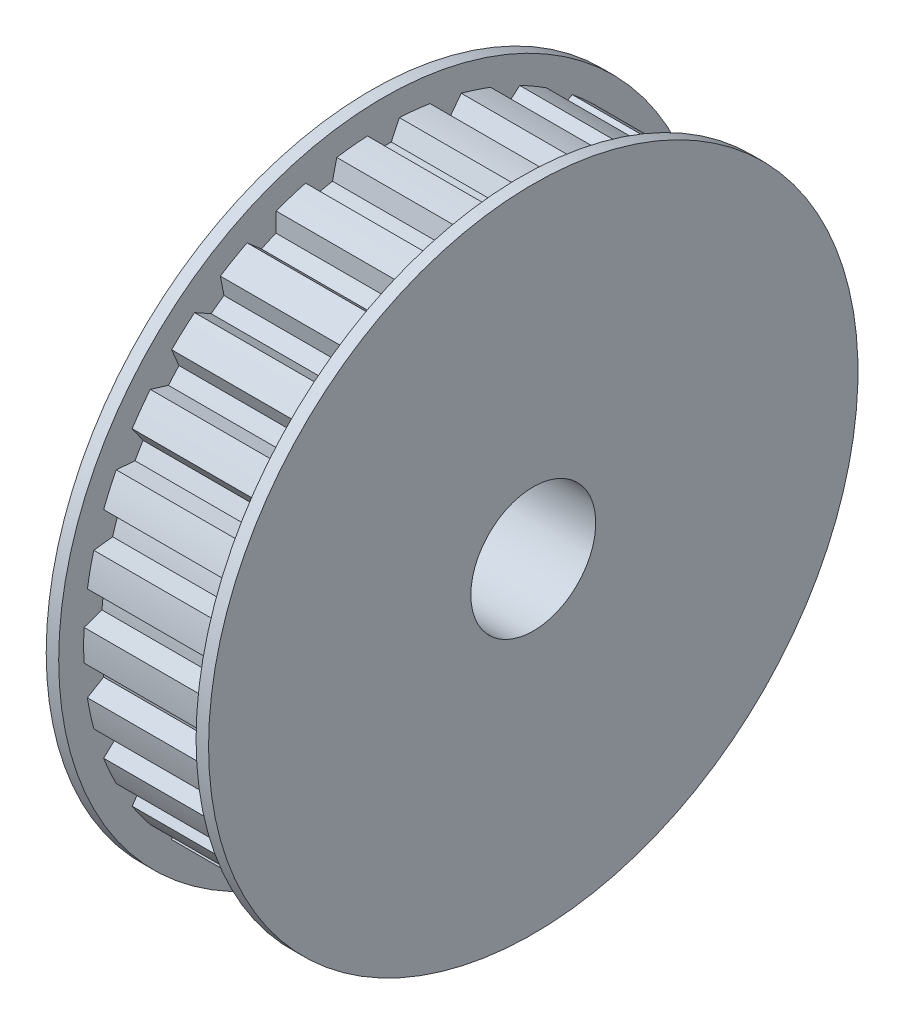
from build123d import *
from build123d.topology import SkipClean

# Parameters (mm, degrees)
SKETCH1_R           = 24
SKETCH1_R_2         = 5
BOSS_EXTRUDE1_DEPTH = 11
CUT_EXTRUDE1_DEPTH  = 36.67912555
BOSS_EXTRUDE2_START = 1
SKETCH3_R           = 26
SKETCH3_R_2         = 5
BOSS_EXTRUDE2_DEPTH = 1
LPATTERN1_COUNT     = 2
LPATTERN1_PITCH     = 12


with BuildPart() as part:
    # Sketch1 → Boss-Extrude1 (new body)
    with BuildSketch(Plane(origin=(0, 0, 0), x_dir=(0, 0, -1), z_dir=(1, 0, 0))):
        Circle(SKETCH1_R)
        Circle(SKETCH1_R_2, mode=Mode.SUBTRACT)
    extrude(amount=BOSS_EXTRUDE1_DEPTH)

    # Sketch2 → Cut-Extrude1 (cut, through all)
    with BuildSketch(Plane.ZY):
        with BuildLine():
            Line((1.276076386, 23.966051595), (0.634916452, 22.59107968))
            ThreePointArc((0.634916452, 22.59107968), (0, 22.6), (-0.634916452, 22.59107968))
            Line((-0.634916452, 22.59107968), (-1.276076386, 23.966051595))
            ThreePointArc((-1.276076386, 23.966051595), (0, 24), (1.276076386, 23.966051595))
        make_face()
        with BuildLine():
            Line((6.231013365, 23.177024668), (5.317991578, 21.965403834))
            ThreePointArc((5.317991578, 21.965403834), (4.698804212, 22.106135777), (4.075907569, 22.22941694))
            Line((4.075907569, 22.22941694), (3.734631254, 23.707647066))
            ThreePointArc((3.734631254, 23.707647066), (4.98988058, 23.475542418), (6.231013365, 23.177024668))
        make_face()
        with BuildLine():
            Line((10.913625159, 21.375050547), (9.768644953, 20.379734438))
            ThreePointArc((9.768644953, 20.379734438), (9.192248134, 20.646127343), (8.608594872, 20.896222011))
            Line((8.608594872, 20.896222011), (8.582117588, 22.413104598))
            ThreePointArc((8.582117588, 22.413104598), (9.761679434, 21.925090983), (10.913625159, 21.375050547))
        make_face()
        with BuildLine():
            Line((15.119259166, 18.638884148), (13.792361669, 17.903372855))
            ThreePointArc((13.792361669, 17.903372855), (13.283946702, 18.283784073), (12.765045269, 18.649761909))
            Line((12.765045269, 18.649761909), (13.054524201, 20.139001909))
            ThreePointArc((13.054524201, 20.139001909), (14.106846055, 19.416407865), (15.119259166, 18.638884148))
        make_face()
        with BuildLine():
            Line((18.664108996, 15.088109073), (17.213285997, 14.644547969))
            ThreePointArc((17.213285997, 14.644547969), (16.795073056, 15.122351704), (16.363601935, 15.58821772))
            Line((16.363601935, 15.58821772), (16.956385464, 16.984728199))
            ThreePointArc((16.956385464, 16.984728199), (17.835475811, 16.059134553), (18.664108996, 15.088109073))
        make_face()
        with BuildLine():
            Line((21.393247703, 10.87791123), (19.881907128, 10.745686063))
            ThreePointArc((19.881907128, 10.745686063), (19.572174126, 11.3), (19.246990676, 11.845393617))
            Line((19.246990676, 11.845393617), (20.117171317, 13.088140365))
            ThreePointArc((20.117171317, 13.088140365), (20.784609691, 12), (21.393247703, 10.87791123))
        make_face()
        with BuildLine():
            Line((23.187398829, 6.192296469), (21.681593513, 6.377186113))
            ThreePointArc((21.681593513, 6.377186113), (21.493877268, 6.983784073), (21.289193566, 7.584868971))
            Line((21.289193566, 7.584868971), (22.39874025, 8.619537993))
            ThreePointArc((22.39874025, 8.619537993), (22.825356391, 7.416407865), (23.187398829, 6.192296469))
        make_face()
        with BuildLine():
            Line((23.96814936, 1.236048638), (22.533690223, 1.729972529))
            ThreePointArc((22.533690223, 1.729972529), (22.476194835, 2.36234327), (22.400956541, 2.992849156))
            Line((22.400956541, 2.992849156), (23.701376753, 3.77422045))
            ThreePointArc((23.701376753, 3.77422045), (23.868525489, 2.508683118), (23.96814936, 1.236048638))
        make_face()
        with BuildLine():
            Line((23.701376753, -3.77422045), (22.400956541, -2.992849156))
            ThreePointArc((22.400956541, -2.992849156), (22.476194835, -2.36234327), (22.533690223, -1.729972529))
            Line((22.533690223, -1.729972529), (23.96814936, -1.236048638))
            ThreePointArc((23.96814936, -1.236048638), (23.868525489, -2.508683118), (23.701376753, -3.77422045))
        make_face()
        with BuildLine():
            Line((22.39874025, -8.619537993), (21.289193566, -7.584868971))
            ThreePointArc((21.289193566, -7.584868971), (21.493877268, -6.983784073), (21.681593513, -6.377186113))
            Line((21.681593513, -6.377186113), (23.187398829, -6.192296469))
            ThreePointArc((23.187398829, -6.192296469), (22.825356391, -7.416407865), (22.39874025, -8.619537993))
        make_face()
        with BuildLine():
            Line((20.117171317, -13.088140365), (19.246990676, -11.845393617))
            ThreePointArc((19.246990676, -11.845393617), (19.572174126, -11.3), (19.881907128, -10.745686063))
            Line((19.881907128, -10.745686063), (21.393247703, -10.87791123))
            ThreePointArc((21.393247703, -10.87791123), (20.784609691, -12), (20.117171317, -13.088140365))
        make_face()
        with BuildLine():
            Line((16.956385464, -16.984728199), (16.363601935, -15.58821772))
            ThreePointArc((16.363601935, -15.58821772), (16.795073056, -15.122351704), (17.213285997, -14.644547969))
            Line((17.213285997, -14.644547969), (18.664108996, -15.088109073))
            ThreePointArc((18.664108996, -15.088109073), (17.835475811, -16.059134553), (16.956385464, -16.984728199))
        make_face()
        with BuildLine():
            Line((13.054524201, -20.139001909), (12.765045269, -18.649761909))
            ThreePointArc((12.765045269, -18.649761909), (13.283946702, -18.283784073), (13.792361669, -17.903372855))
            Line((13.792361669, -17.903372855), (15.119259166, -18.638884148))
            ThreePointArc((15.119259166, -18.638884148), (14.106846055, -19.416407865), (13.054524201, -20.139001909))
        make_face()
        with BuildLine():
            Line((8.582117588, -22.413104598), (8.608594872, -20.896222011))
            ThreePointArc((8.608594872, -20.896222011), (9.192248134, -20.646127343), (9.768644953, -20.379734438))
            Line((9.768644953, -20.379734438), (10.913625159, -21.375050547))
            ThreePointArc((10.913625159, -21.375050547), (9.761679434, -21.925090983), (8.582117588, -22.413104598))
        make_face()
        with BuildLine():
            Line((3.734631254, -23.707647066), (4.075907569, -22.22941694))
            ThreePointArc((4.075907569, -22.22941694), (4.698804212, -22.106135777), (5.317991578, -21.965403834))
            Line((5.317991578, -21.965403834), (6.231013365, -23.177024668))
            ThreePointArc((6.231013365, -23.177024668), (4.98988058, -23.475542418), (3.734631254, -23.707647066))
        make_face()
        with BuildLine():
            Line((-1.276076386, -23.966051595), (-0.634916452, -22.59107968))
            ThreePointArc((-0.634916452, -22.59107968), (0, -22.6), (0.634916452, -22.59107968))
            Line((0.634916452, -22.59107968), (1.276076386, -23.966051595))
            ThreePointArc((1.276076386, -23.966051595), (0, -24), (-1.276076386, -23.966051595))
        make_face()
        with BuildLine():
            Line((-6.231013365, -23.177024668), (-5.317991578, -21.965403834))
            ThreePointArc((-5.317991578, -21.965403834), (-4.698804212, -22.106135777), (-4.075907569, -22.22941694))
            Line((-4.075907569, -22.22941694), (-3.734631254, -23.707647066))
            ThreePointArc((-3.734631254, -23.707647066), (-4.98988058, -23.475542418), (-6.231013365, -23.177024668))
        make_face()
        with BuildLine():
            Line((-10.913625159, -21.375050547), (-9.768644953, -20.379734438))
            ThreePointArc((-9.768644953, -20.379734438), (-9.192248134, -20.646127343), (-8.608594872, -20.896222011))
            Line((-8.608594872, -20.896222011), (-8.582117588, -22.413104598))
            ThreePointArc((-8.582117588, -22.413104598), (-9.761679434, -21.925090983), (-10.913625159, -21.375050547))
        make_face()
        with BuildLine():
            Line((-15.119259166, -18.638884148), (-13.792361669, -17.903372855))
            ThreePointArc((-13.792361669, -17.903372855), (-13.283946702, -18.283784073), (-12.765045269, -18.649761909))
            Line((-12.765045269, -18.649761909), (-13.054524201, -20.139001909))
            ThreePointArc((-13.054524201, -20.139001909), (-14.106846055, -19.416407865), (-15.119259166, -18.638884148))
        make_face()
        with BuildLine():
            Line((-18.664108996, -15.088109073), (-17.213285997, -14.644547969))
            ThreePointArc((-17.213285997, -14.644547969), (-16.795073056, -15.122351704), (-16.363601935, -15.58821772))
            Line((-16.363601935, -15.58821772), (-16.956385464, -16.984728199))
            ThreePointArc((-16.956385464, -16.984728199), (-17.835475811, -16.059134553), (-18.664108996, -15.088109073))
        make_face()
        with BuildLine():
            Line((-21.393247703, -10.87791123), (-19.881907128, -10.745686063))
            ThreePointArc((-19.881907128, -10.745686063), (-19.572174126, -11.3), (-19.246990676, -11.845393617))
            Line((-19.246990676, -11.845393617), (-20.117171317, -13.088140365))
            ThreePointArc((-20.117171317, -13.088140365), (-20.784609691, -12), (-21.393247703, -10.87791123))
        make_face()
        with BuildLine():
            Line((-23.187398829, -6.192296469), (-21.681593513, -6.377186113))
            ThreePointArc((-21.681593513, -6.377186113), (-21.493877268, -6.983784073), (-21.289193566, -7.584868971))
            Line((-21.289193566, -7.584868971), (-22.39874025, -8.619537993))
            ThreePointArc((-22.39874025, -8.619537993), (-22.825356391, -7.416407865), (-23.187398829, -6.192296469))
        make_face()
        with BuildLine():
            Line((-23.96814936, -1.236048638), (-22.533690223, -1.729972529))
            ThreePointArc((-22.533690223, -1.729972529), (-22.476194835, -2.36234327), (-22.400956541, -2.992849156))
            Line((-22.400956541, -2.992849156), (-23.701376753, -3.77422045))
            ThreePointArc((-23.701376753, -3.77422045), (-23.868525489, -2.508683118), (-23.96814936, -1.236048638))
        make_face()
        with BuildLine():
            Line((-23.701376753, 3.77422045), (-22.400956541, 2.992849156))
            ThreePointArc((-22.400956541, 2.992849156), (-22.476194835, 2.36234327), (-22.533690223, 1.729972529))
            Line((-22.533690223, 1.729972529), (-23.96814936, 1.236048638))
            ThreePointArc((-23.96814936, 1.236048638), (-23.868525489, 2.508683118), (-23.701376753, 3.77422045))
        make_face()
        with BuildLine():
            Line((-22.39874025, 8.619537993), (-21.289193566, 7.584868971))
            ThreePointArc((-21.289193566, 7.584868971), (-21.493877268, 6.983784073), (-21.681593513, 6.377186113))
            Line((-21.681593513, 6.377186113), (-23.187398829, 6.192296469))
            ThreePointArc((-23.187398829, 6.192296469), (-22.825356391, 7.416407865), (-22.39874025, 8.619537993))
        make_face()
        with BuildLine():
            Line((-20.117171317, 13.088140365), (-19.246990676, 11.845393617))
            ThreePointArc((-19.246990676, 11.845393617), (-19.572174126, 11.3), (-19.881907128, 10.745686063))
            Line((-19.881907128, 10.745686063), (-21.393247703, 10.87791123))
            ThreePointArc((-21.393247703, 10.87791123), (-20.784609691, 12), (-20.117171317, 13.088140365))
        make_face()
        with BuildLine():
            Line((-16.956385464, 16.984728199), (-16.363601935, 15.58821772))
            ThreePointArc((-16.363601935, 15.58821772), (-16.795073056, 15.122351704), (-17.213285997, 14.644547969))
            Line((-17.213285997, 14.644547969), (-18.664108996, 15.088109073))
            ThreePointArc((-18.664108996, 15.088109073), (-17.835475811, 16.059134553), (-16.956385464, 16.984728199))
        make_face()
        with BuildLine():
            Line((-13.054524201, 20.139001909), (-12.765045269, 18.649761909))
            ThreePointArc((-12.765045269, 18.649761909), (-13.283946702, 18.283784073), (-13.792361669, 17.903372855))
            Line((-13.792361669, 17.903372855), (-15.119259166, 18.638884148))
            ThreePointArc((-15.119259166, 18.638884148), (-14.106846055, 19.416407865), (-13.054524201, 20.139001909))
        make_face()
        with BuildLine():
            Line((-8.582117588, 22.413104598), (-8.608594872, 20.896222011))
            ThreePointArc((-8.608594872, 20.896222011), (-9.192248134, 20.646127343), (-9.768644953, 20.379734438))
            Line((-9.768644953, 20.379734438), (-10.913625159, 21.375050547))
            ThreePointArc((-10.913625159, 21.375050547), (-9.761679434, 21.925090983), (-8.582117588, 22.413104598))
        make_face()
        with BuildLine():
            Line((-3.734631254, 23.707647066), (-4.075907569, 22.22941694))
            ThreePointArc((-4.075907569, 22.22941694), (-4.698804212, 22.106135777), (-5.317991578, 21.965403834))
            Line((-5.317991578, 21.965403834), (-6.231013365, 23.177024668))
            ThreePointArc((-6.231013365, 23.177024668), (-4.98988058, 23.475542418), (-3.734631254, 23.707647066))
        make_face()
    extrude(amount=-CUT_EXTRUDE1_DEPTH, mode=Mode.SUBTRACT)

    # Sketch3 → Boss-Extrude2 (add)
    with SkipClean():  # the faces are left unmerged after this step: merging them gives an invalid solid
        with BuildSketch(Plane.ZY.offset(BOSS_EXTRUDE2_START)):
            Circle(SKETCH3_R)
            Circle(SKETCH3_R_2, mode=Mode.SUBTRACT)
        boss_extrude2 = extrude(amount=-BOSS_EXTRUDE2_DEPTH)

    # LPattern1: Boss-Extrude2 ×2
    with Locations(*[(i * LPATTERN1_PITCH, 0, 0) for i in range(1, LPATTERN1_COUNT)]):
        add(boss_extrude2)


solid = part.part
